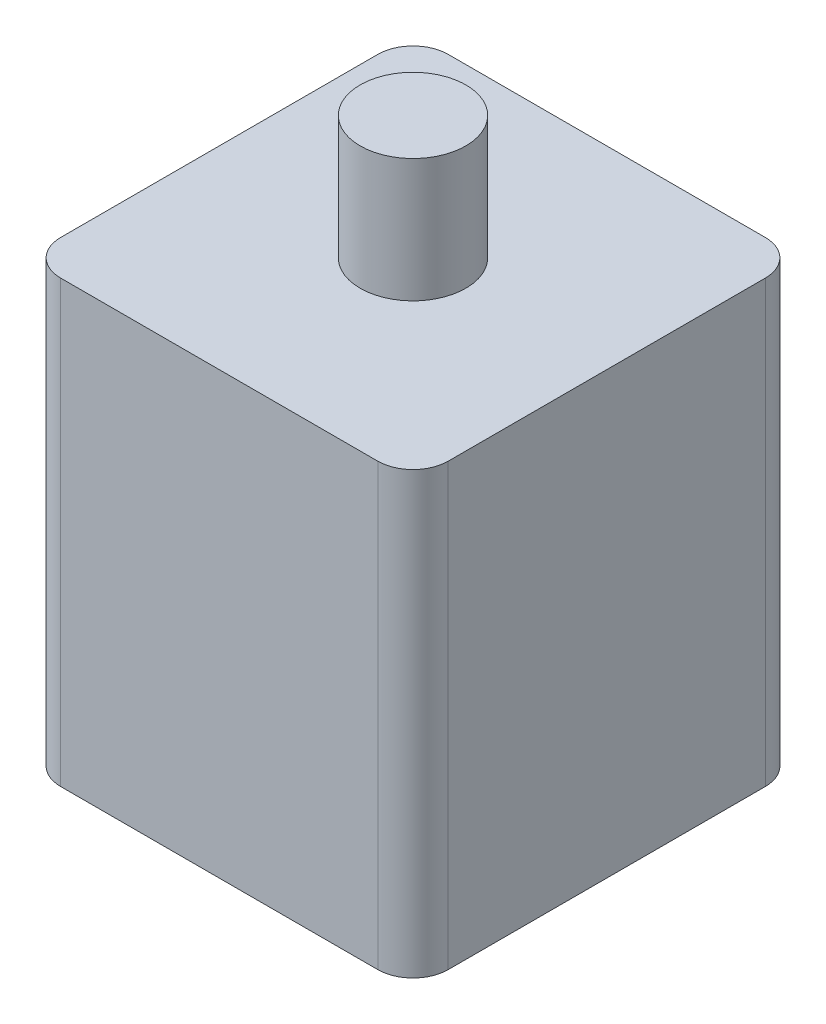
from build123d import *

# Parameters (mm, degrees)
SKETCH1_R           = 6
BOSS_EXTRUDE1_DEPTH = 25
SKETCH2_R           = 3
BOSS_EXTRUDE2_DEPTH = 7
SCALE1_SCALE        = 0.7


with BuildPart() as part:
    # Sketch1 → Boss-Extrude1 (new body)
    # profile 1 of 2: a face of its own
    with BuildSketch(Plane(origin=(0, 0, 0), x_dir=(1, 0, 0), z_dir=(0, 1, 0))):
        with BuildLine():
            ThreePointArc((-11, 9), (-10.414213562, 10.414213562), (-9, 11))
            Line((-9, 11), (9, 11))
            ThreePointArc((9, 11), (10.414213562, 10.414213562), (11, 9))
            Line((11, 9), (11, -9))
            ThreePointArc((11, -9), (10.414213562, -10.414213562), (9, -11))
            Line((9, -11), (-9, -11))
            ThreePointArc((-9, -11), (-10.414213562, -10.414213562), (-11, -9))
            Line((-11, -9), (-11, 9))
        make_face()
        Circle(SKETCH1_R, mode=Mode.SUBTRACT)
    # profile 2 of 2: a face of its own
    with BuildSketch(Plane(origin=(0, 0, 0), x_dir=(1, 0, 0), z_dir=(0, 1, 0))):
        Circle(SKETCH1_R)
    extrude(amount=BOSS_EXTRUDE1_DEPTH)

    # Sketch2 → Boss-Extrude2 (add)
    with BuildSketch(Plane(origin=(0, 25, 0), x_dir=(1, 0, 0), z_dir=(0, 1, 0))):
        with Locations(Location((0, 0, 0), (0, 0, 270))):
            Circle(SKETCH2_R)
    extrude(amount=BOSS_EXTRUDE2_DEPTH)


with BuildPart() as part_1:
    # Scale1: scaled about (0, 12.759310903, 0)
    add(part.part.scale(SCALE1_SCALE).moved(Location((0, 3.827793271, 0))))


solid = part_1.part
